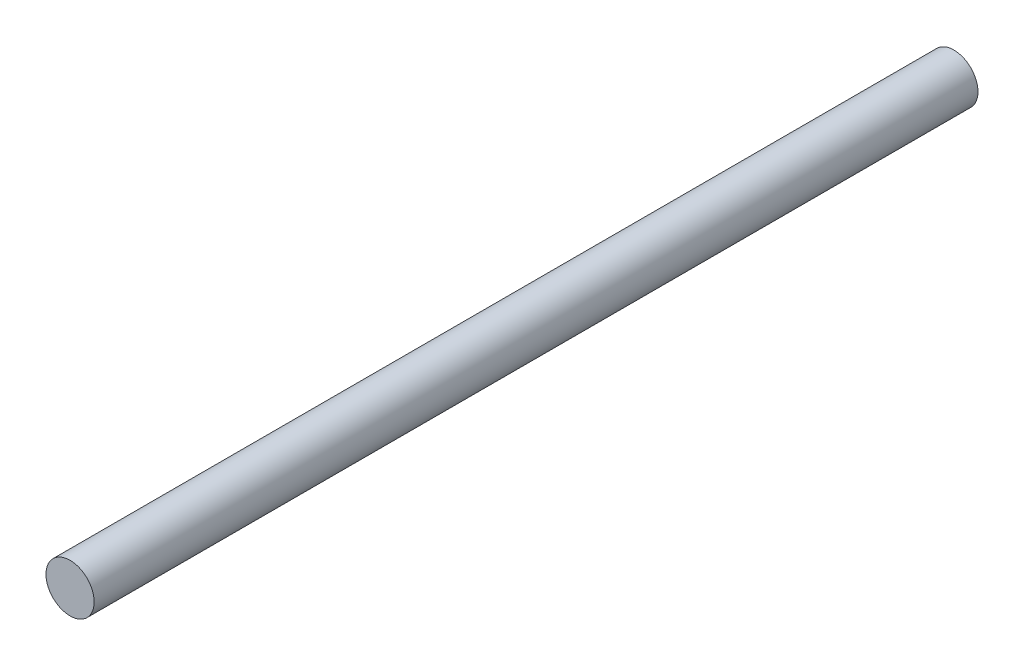
from build123d import *

# Parameters (mm, degrees)
SKETCH1_R           = 1.5
BOSS_EXTRUDE2_DEPTH = 55


with BuildPart() as part:
    # Sketch1 → Boss-Extrude2 (new body)
    with BuildSketch(Plane.XY):
        Circle(SKETCH1_R)
    extrude(amount=BOSS_EXTRUDE2_DEPTH)


solid = part.part
